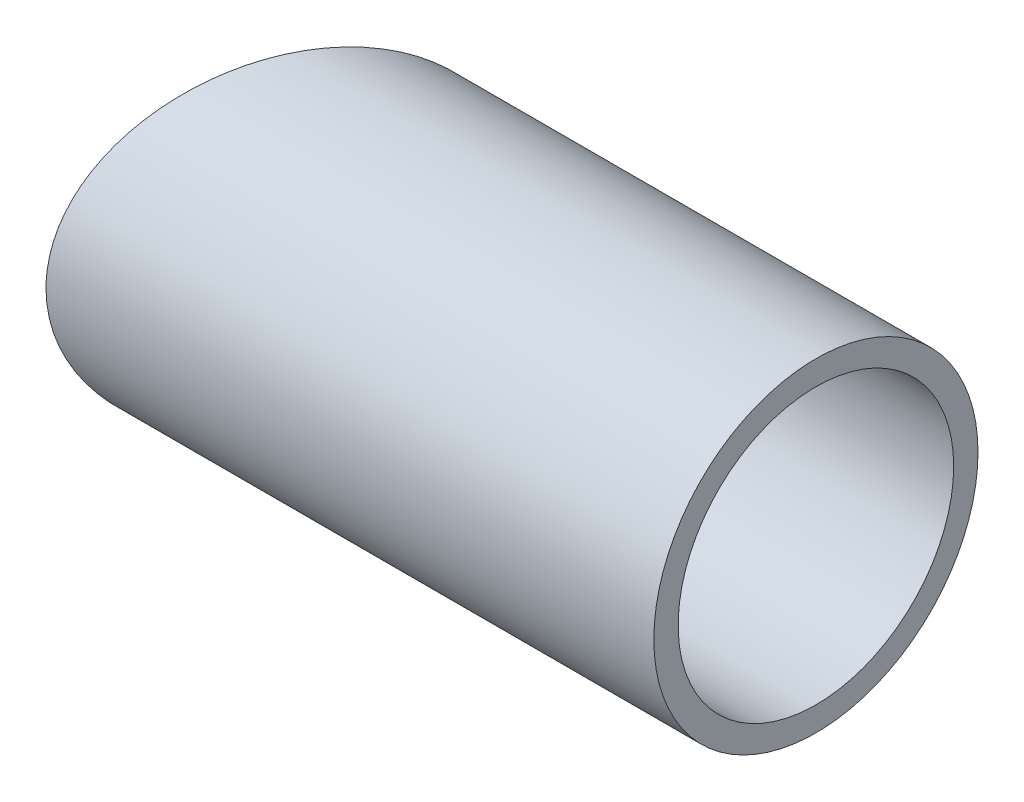
from build123d import *

# Parameters (mm, degrees)
SKETCH1_R               = 20
BOSS_EXTRUDE1_DEPTH     = 75
CUT_EXTRUDE2_DEPTH      = 81.156097709
CUT_EXTRUDE2_DEPTH_BACK = 81.156097709
SKETCH3_R               = 14.5
SKETCH4_R               = 17
CUT_EXTRUDE3_DEPTH      = 25
CUT_EXTRUDE4_DEPTH      = 81.156097709
CUT_EXTRUDE4_DEPTH_BACK = 81.156097709
SKETCH5_R               = 501.5


with BuildPart() as part:
    # Sketch1 → Boss-Extrude1 (new body)
    with BuildSketch(Plane(origin=(0, 0, 0), x_dir=(0, 0, -1), z_dir=(1, 0, 0))):
        Circle(SKETCH1_R)
    extrude(amount=BOSS_EXTRUDE1_DEPTH)

    # Sketch3 → Cut-Extrude2 (cut, two sides: drawn at the far end of the back side and taken through both)
    with BuildSketch(Plane(origin=(75, 0, 0), x_dir=(0, 0, -1), z_dir=(1, 0, 0)).offset(-CUT_EXTRUDE2_DEPTH_BACK)):
        Circle(SKETCH3_R)
    extrude(amount=CUT_EXTRUDE2_DEPTH + CUT_EXTRUDE2_DEPTH_BACK, mode=Mode.SUBTRACT)

    # Sketch4 → Cut-Extrude3 (cut)
    with BuildSketch(Plane(origin=(75, 0, 0), x_dir=(0, 0, -1), z_dir=(1, 0, 0))):
        Circle(SKETCH4_R)
    extrude(amount=-CUT_EXTRUDE3_DEPTH, mode=Mode.SUBTRACT)

    # Sketch5 → Cut-Extrude4 (cut, two sides: drawn at the far end of the back side and taken through both)
    with BuildSketch(Plane(origin=(0, 0, 0), x_dir=(1, 0, 0), z_dir=(0, 1, 0)).offset(-CUT_EXTRUDE4_DEPTH_BACK)):
        with Locations((-445.130598813, 211)):
            Circle(SKETCH5_R)
    extrude(amount=CUT_EXTRUDE4_DEPTH + CUT_EXTRUDE4_DEPTH_BACK, mode=Mode.SUBTRACT)


solid = part.part
